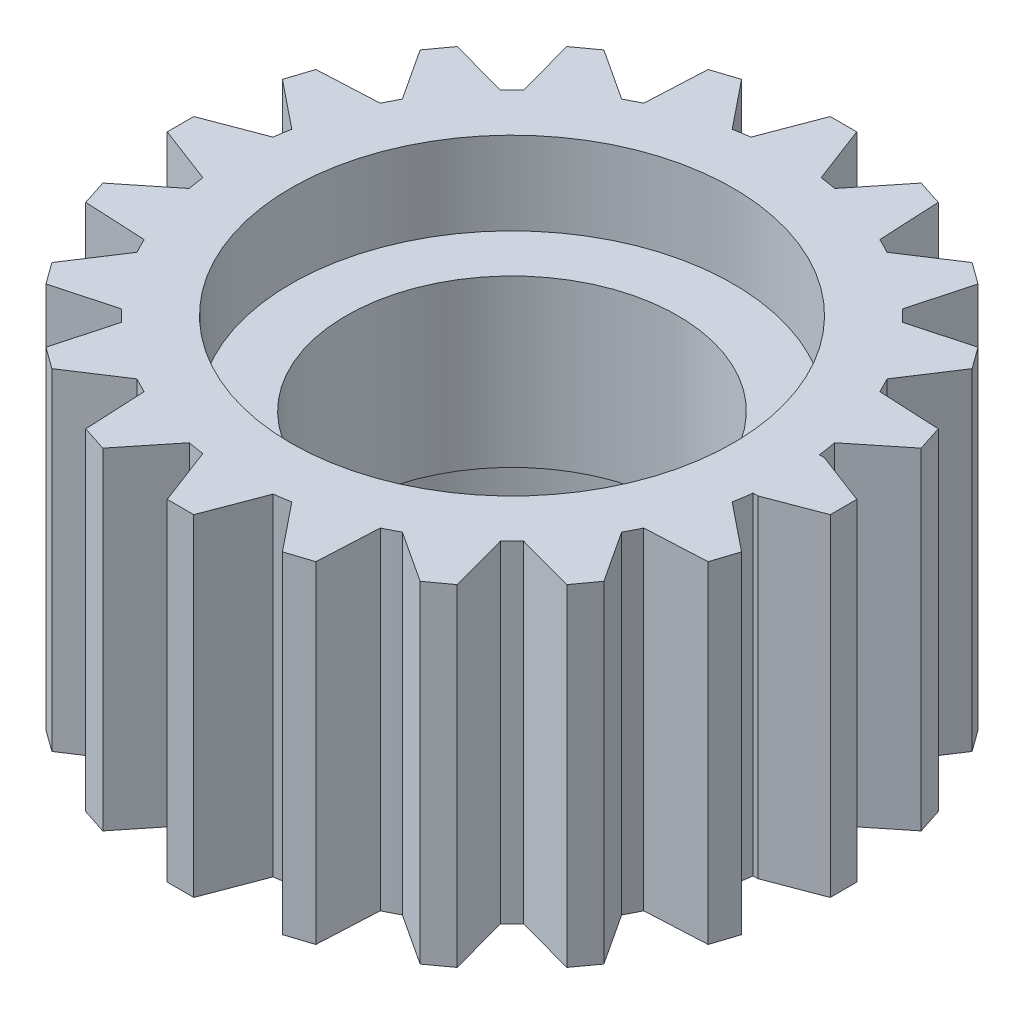
from build123d import *

# Parameters (mm, degrees)
SKETCH2_R           = 15
BOSS_EXTRUDE1_DEPTH = 30
SKETCH6_R           = 20
CUT_EXTRUDE2_DEPTH  = 7.5
CUT_EXTRUDE3_START  = -22.5
SKETCH6_2_R         = 20
CUT_EXTRUDE3_DEPTH  = 7.5


with BuildPart() as part:
    # Sketch2 → Boss-Extrude1 (new body)
    with BuildSketch(Plane(origin=(0, 0, 0), x_dir=(1, 0, 0), z_dir=(0, 1, 0))):
        with BuildLine():
            ThreePointArc((24.819347292, 3), (24.706042922, 3.822491744), (24.565489544, 4.640767551))
            Line((24.565489544, 4.640767551), (28.902515882, 8.129242012))
            Line((28.902515882, 8.129242012), (28.160875096, 10.411777651))
            Line((28.160875096, 10.411777651), (22.601673242, 10.684772654))
            ThreePointArc((22.601673242, 10.684772654), (22.275163105, 11.349762493), (21.929092867, 12.004785964))
            Line((21.929092867, 12.004785964), (24.975852134, 16.662737176))
            Line((24.975852134, 16.662737176), (23.565167528, 18.604377962))
            Line((23.565167528, 18.604377962), (18.193692285, 17.146123791))
            ThreePointArc((18.193692285, 17.146123791), (17.67766953, 17.67766953), (17.146123791, 18.193692285))
            Line((17.146123791, 18.193692285), (18.604377962, 23.565167528))
            Line((18.604377962, 23.565167528), (16.662737176, 24.975852134))
            Line((16.662737176, 24.975852134), (12.004785964, 21.929092867))
            ThreePointArc((12.004785964, 21.929092867), (11.349762493, 22.275163105), (10.684772654, 22.601673242))
            Line((10.684772654, 22.601673242), (10.411777651, 28.160875096))
            Line((10.411777651, 28.160875096), (8.129242012, 28.902515882))
            Line((8.129242012, 28.902515882), (4.640767551, 24.565489544))
            ThreePointArc((4.640767551, 24.565489544), (3.910861626, 24.692208515), (3.177521525, 24.797244947))
            Line((3.177521525, 24.797244947), (1.2, 30))
            Line((1.2, 30), (-1.2, 30))
            Line((-1.2, 30), (-3.177521525, 24.797244947))
            ThreePointArc((-3.177521525, 24.797244947), (-3.910861626, 24.692208515), (-4.640767551, 24.565489544))
            Line((-4.640767551, 24.565489544), (-8.129242012, 28.902515882))
            Line((-8.129242012, 28.902515882), (-10.411777651, 28.160875096))
            Line((-10.411777651, 28.160875096), (-10.684772654, 22.601673242))
            ThreePointArc((-10.684772654, 22.601673242), (-11.349762493, 22.275163105), (-12.004785964, 21.929092867))
            Line((-12.004785964, 21.929092867), (-16.662737176, 24.975852134))
            Line((-16.662737176, 24.975852134), (-18.604377962, 23.565167528))
            Line((-18.604377962, 23.565167528), (-17.146123791, 18.193692285))
            ThreePointArc((-17.146123791, 18.193692285), (-17.67766953, 17.67766953), (-18.193692285, 17.146123791))
            Line((-18.193692285, 17.146123791), (-23.565167528, 18.604377962))
            Line((-23.565167528, 18.604377962), (-24.975852134, 16.662737176))
            Line((-24.975852134, 16.662737176), (-21.929092867, 12.004785964))
            ThreePointArc((-21.929092867, 12.004785964), (-22.275163105, 11.349762493), (-22.601673242, 10.684772654))
            Line((-22.601673242, 10.684772654), (-28.160875096, 10.411777651))
            Line((-28.160875096, 10.411777651), (-28.902515882, 8.129242012))
            Line((-28.902515882, 8.129242012), (-24.565489544, 4.640767551))
            ThreePointArc((-24.565489544, 4.640767551), (-24.692208515, 3.910861626), (-24.797244947, 3.177521525))
            Line((-24.797244947, 3.177521525), (-30, 1.2))
            Line((-30, 1.2), (-30, -1.2))
            Line((-30, -1.2), (-24.797244947, -3.177521525))
            ThreePointArc((-24.797244947, -3.177521525), (-24.692208515, -3.910861626), (-24.565489544, -4.640767551))
            Line((-24.565489544, -4.640767551), (-28.902515882, -8.129242012))
            Line((-28.902515882, -8.129242012), (-28.160875096, -10.411777651))
            Line((-28.160875096, -10.411777651), (-22.601673242, -10.684772654))
            ThreePointArc((-22.601673242, -10.684772654), (-22.275163105, -11.349762493), (-21.929092867, -12.004785964))
            Line((-21.929092867, -12.004785964), (-24.975852134, -16.662737176))
            Line((-24.975852134, -16.662737176), (-23.565167528, -18.604377962))
            Line((-23.565167528, -18.604377962), (-18.193692285, -17.146123791))
            ThreePointArc((-18.193692285, -17.146123791), (-17.67766953, -17.67766953), (-17.146123791, -18.193692285))
            Line((-17.146123791, -18.193692285), (-18.604377962, -23.565167529))
            Line((-18.604377962, -23.565167529), (-16.662737176, -24.975852134))
            Line((-16.662737176, -24.975852134), (-12.004785964, -21.929092867))
            ThreePointArc((-12.004785964, -21.929092867), (-11.349762493, -22.275163105), (-10.684772654, -22.601673242))
            Line((-10.684772654, -22.601673242), (-10.411777651, -28.160875096))
            Line((-10.411777651, -28.160875096), (-8.129242012, -28.902515882))
            Line((-8.129242012, -28.902515882), (-4.640767551, -24.565489544))
            ThreePointArc((-4.640767551, -24.565489544), (-3.910861626, -24.692208515), (-3.177521525, -24.797244947))
            Line((-3.177521525, -24.797244947), (-1.2, -30))
            Line((-1.2, -30), (1.2, -30))
            Line((1.2, -30), (3.177521525, -24.797244947))
            ThreePointArc((3.177521525, -24.797244947), (3.910861626, -24.692208515), (4.640767551, -24.565489544))
            Line((4.640767551, -24.565489544), (8.129242012, -28.902515882))
            Line((8.129242012, -28.902515882), (10.411777651, -28.160875096))
            Line((10.411777651, -28.160875096), (10.684772654, -22.601673242))
            ThreePointArc((10.684772654, -22.601673242), (11.349762493, -22.275163105), (12.004785964, -21.929092867))
            Line((12.004785964, -21.929092867), (16.662737176, -24.975852134))
            Line((16.662737176, -24.975852134), (18.604377962, -23.565167528))
            Line((18.604377962, -23.565167528), (17.146123791, -18.193692285))
            ThreePointArc((17.146123791, -18.193692285), (17.67766953, -17.67766953), (18.193692285, -17.146123791))
            Line((18.193692285, -17.146123791), (23.565167529, -18.604377962))
            Line((23.565167529, -18.604377962), (24.975852134, -16.662737176))
            Line((24.975852134, -16.662737176), (21.929092867, -12.004785964))
            ThreePointArc((21.929092867, -12.004785964), (22.275163105, -11.349762493), (22.601673242, -10.684772654))
            Line((22.601673242, -10.684772654), (28.160875096, -10.411777651))
            Line((28.160875096, -10.411777651), (28.902515882, -8.129242012))
            Line((28.902515882, -8.129242012), (24.565489544, -4.640767551))
            ThreePointArc((24.565489544, -4.640767551), (24.706042922, -3.822491744), (24.819347292, -3))
            Line((24.819347292, -3), (25.264294735, -3))
            Line((25.264294735, -3), (30, -1.2))
            Line((30, -1.2), (30, 1.2))
            Line((30, 1.2), (25.264294735, 3))
            Line((25.264294735, 3), (24.819347292, 3))
        make_face()
        Circle(SKETCH2_R, mode=Mode.SUBTRACT)
    extrude(amount=BOSS_EXTRUDE1_DEPTH)

    # Sketch6 → Cut-Extrude2 (cut)
    with BuildSketch(Plane(origin=(0, 30, 0), x_dir=(1, 0, 0), z_dir=(0, 1, 0))):
        Circle(SKETCH6_R)
    extrude(amount=-CUT_EXTRUDE2_DEPTH, mode=Mode.SUBTRACT)

    # Sketch6<2> → Cut-Extrude3 (cut)
    with BuildSketch(Plane(origin=(0, 30, 0), x_dir=(1, 0, 0), z_dir=(0, 1, 0)).offset(CUT_EXTRUDE3_START)):
        Circle(SKETCH6_2_R)
    extrude(amount=-CUT_EXTRUDE3_DEPTH, mode=Mode.SUBTRACT)


solid = part.part
